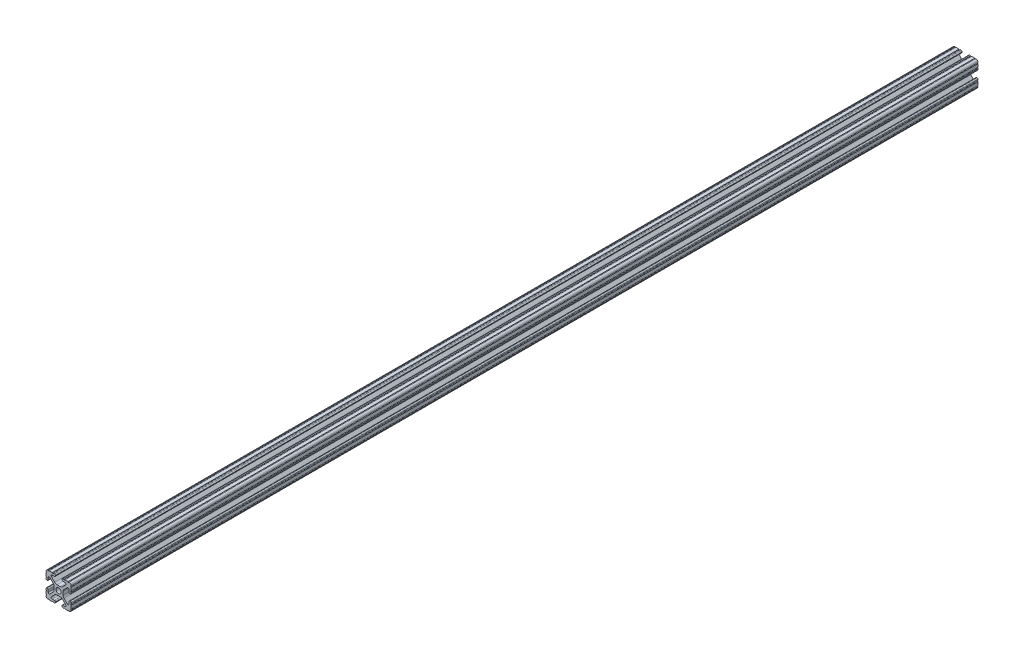
from build123d import *

# Parameters (mm, degrees)
SKETCH1_R      = 2.6035
EXTRUDE1_DEPTH = 914.4


with BuildPart() as part:
    # Sketch1 → Extrude1 (new body)
    with BuildSketch(Plane.XY):
        with BuildLine():
            Line((-7.207036008, 8.724370562), (-3.898272566, 5.423169045))
            ThreePointArc((-3.898272566, 5.423169045), (-2.869120213, 4.736787962), (-1.655778399, 4.4958))
            Line((-1.655778399, 4.4958), (1.655778399, 4.4958))
            ThreePointArc((1.655778399, 4.4958), (2.869120213, 4.736787962), (3.898272566, 5.423169045))
            Line((3.898272566, 5.423169045), (7.207036008, 8.724370562))
            ThreePointArc((7.207036008, 8.724370562), (7.432222385, 9.85140422), (6.476788598, 10.4902))
            Line((6.476788598, 10.4902), (4.287512407, 10.4902))
            ThreePointArc((4.287512407, 10.4902), (3.54574862, 10.79744862), (3.2385, 11.539212407))
            Line((3.2385, 11.539212407), (3.2385, 11.650987593))
            ThreePointArc((3.2385, 11.650987593), (3.54574862, 12.39275138), (4.287512407, 12.7))
            Line((4.287512407, 12.7), (5.317126718, 12.7))
            ThreePointArc((5.317126718, 12.7), (5.825126718, 12.192), (6.333126718, 12.7))
            Line((6.333126718, 12.7), (9.550443118, 12.7))
            ThreePointArc((9.550443118, 12.7), (10.058366869, 12.192000006), (10.566443095, 12.699847501))
            ThreePointArc((10.566443095, 12.699847501), (12.082537762, 12.08250727), (12.699846982, 10.566399977))
            ThreePointArc((12.699846982, 10.566399977), (12.192000006, 10.058323491), (12.7, 9.5504))
            Line((12.7, 9.5504), (12.7, 6.3330836))
            ThreePointArc((12.7, 6.3330836), (12.192, 5.8250836), (12.7, 5.3170836))
            Line((12.7, 5.3170836), (12.7, 4.287469289))
            ThreePointArc((12.7, 4.287469289), (12.39275138, 3.545705502), (11.650987593, 3.238456882))
            Line((11.650987593, 3.238456882), (11.539212407, 3.238456882))
            ThreePointArc((11.539212407, 3.238456882), (10.79744862, 3.545705502), (10.4902, 4.287469289))
            Line((10.4902, 4.287469289), (10.4902, 6.402089023))
            ThreePointArc((10.4902, 6.402089023), (9.856505071, 7.351067942), (8.737131347, 7.129408934))
            Line((8.737131347, 7.129408934), (5.441005833, 3.840816462))
            ThreePointArc((5.441005833, 3.840816462), (4.750877967, 2.809883091), (4.5085, 1.593185507))
            Line((4.5085, 1.593185507), (4.5085, -1.593185507))
            ThreePointArc((4.5085, -1.593185507), (4.750877967, -2.809883091), (5.441005833, -3.840816462))
            Line((5.441005833, -3.840816462), (8.737131347, -7.129408934))
            ThreePointArc((8.737131347, -7.129408934), (9.856505071, -7.351067942), (10.4902, -6.402089023))
            Line((10.4902, -6.402089023), (10.4902, -4.287469289))
            ThreePointArc((10.4902, -4.287469289), (10.79744862, -3.545705502), (11.539212407, -3.238456882))
            Line((11.539212407, -3.238456882), (11.650987593, -3.238456882))
            ThreePointArc((11.650987593, -3.238456882), (12.39275138, -3.545705502), (12.7, -4.287469289))
            Line((12.7, -4.287469289), (12.7, -5.3170836))
            ThreePointArc((12.7, -5.3170836), (12.192, -5.8250836), (12.7, -6.3330836))
            Line((12.7, -6.3330836), (12.7, -9.5504))
            ThreePointArc((12.7, -9.5504), (12.192000006, -10.058323491), (12.699846982, -10.566399977))
            ThreePointArc((12.699846982, -10.566399977), (12.082537762, -12.08250727), (10.566443095, -12.699847501))
            ThreePointArc((10.566443095, -12.699847501), (10.058366869, -12.192000006), (9.550443118, -12.7))
            Line((9.550443118, -12.7), (6.333126718, -12.7))
            ThreePointArc((6.333126718, -12.7), (5.825126718, -12.192), (5.317126718, -12.7))
            Line((5.317126718, -12.7), (4.287512407, -12.7))
            ThreePointArc((4.287512407, -12.7), (3.54574862, -12.39275138), (3.2385, -11.650987593))
            Line((3.2385, -11.650987593), (3.2385, -11.539212407))
            ThreePointArc((3.2385, -11.539212407), (3.54574862, -10.79744862), (4.287512407, -10.4902))
            Line((4.287512407, -10.4902), (6.416408329, -10.4902))
            ThreePointArc((6.416408329, -10.4902), (7.41473083, -9.822813117), (7.179650497, -8.645192506))
            Line((7.179650497, -8.645192506), (3.952270251, -5.423690499))
            ThreePointArc((3.952270251, -5.423690499), (2.922936451, -4.736929036), (1.709253557, -4.4958))
            Line((1.709253557, -4.4958), (-1.709253557, -4.4958))
            ThreePointArc((-1.709253557, -4.4958), (-2.922936451, -4.736929036), (-3.952270251, -5.423690499))
            Line((-3.952270251, -5.423690499), (-7.179650497, -8.645192506))
            ThreePointArc((-7.179650497, -8.645192506), (-7.41473083, -9.822813117), (-6.416408329, -10.4902))
            Line((-6.416408329, -10.4902), (-4.287512407, -10.4902))
            ThreePointArc((-4.287512407, -10.4902), (-3.54574862, -10.79744862), (-3.2385, -11.539212407))
            Line((-3.2385, -11.539212407), (-3.2385, -11.650987593))
            ThreePointArc((-3.2385, -11.650987593), (-3.54574862, -12.39275138), (-4.287512407, -12.7))
            Line((-4.287512407, -12.7), (-5.317126718, -12.7))
            ThreePointArc((-5.317126718, -12.7), (-5.825126718, -12.192), (-6.333126718, -12.7))
            Line((-6.333126718, -12.7), (-9.550443118, -12.7))
            ThreePointArc((-9.550443118, -12.7), (-10.058366869, -12.192000006), (-10.566443095, -12.699847501))
            ThreePointArc((-10.566443095, -12.699847501), (-12.082537762, -12.08250727), (-12.699846982, -10.566399977))
            ThreePointArc((-12.699846982, -10.566399977), (-12.192000006, -10.058323491), (-12.7, -9.5504))
            Line((-12.7, -9.5504), (-12.7, -6.3330836))
            ThreePointArc((-12.7, -6.3330836), (-12.192, -5.8250836), (-12.7, -5.3170836))
            Line((-12.7, -5.3170836), (-12.7, -4.287469289))
            ThreePointArc((-12.7, -4.287469289), (-12.39275138, -3.545705502), (-11.650987593, -3.238456882))
            Line((-11.650987593, -3.238456882), (-11.539212407, -3.238456882))
            ThreePointArc((-11.539212407, -3.238456882), (-10.79744862, -3.545705502), (-10.4902, -4.287469289))
            Line((-10.4902, -4.287469289), (-10.4902, -6.402089023))
            ThreePointArc((-10.4902, -6.402089023), (-9.856505071, -7.351067942), (-8.737131347, -7.129408934))
            Line((-8.737131347, -7.129408934), (-5.441005833, -3.840816462))
            ThreePointArc((-5.441005833, -3.840816462), (-4.750877967, -2.809883091), (-4.5085, -1.593185507))
            Line((-4.5085, -1.593185507), (-4.5085, 1.593185507))
            ThreePointArc((-4.5085, 1.593185507), (-4.750877967, 2.809883091), (-5.441005833, 3.840816462))
            Line((-5.441005833, 3.840816462), (-8.737131347, 7.129408934))
            ThreePointArc((-8.737131347, 7.129408934), (-9.856505071, 7.351067942), (-10.4902, 6.402089023))
            Line((-10.4902, 6.402089023), (-10.4902, 4.287469289))
            ThreePointArc((-10.4902, 4.287469289), (-10.79744862, 3.545705502), (-11.539212407, 3.238456882))
            Line((-11.539212407, 3.238456882), (-11.650987593, 3.238456882))
            ThreePointArc((-11.650987593, 3.238456882), (-12.39275138, 3.545705502), (-12.7, 4.287469289))
            Line((-12.7, 4.287469289), (-12.7, 5.3170836))
            ThreePointArc((-12.7, 5.3170836), (-12.192, 5.8250836), (-12.7, 6.3330836))
            Line((-12.7, 6.3330836), (-12.7, 9.5504))
            ThreePointArc((-12.7, 9.5504), (-12.192000006, 10.058323491), (-12.699846982, 10.566399977))
            ThreePointArc((-12.699846982, 10.566399977), (-12.082537762, 12.08250727), (-10.566443095, 12.699847501))
            ThreePointArc((-10.566443095, 12.699847501), (-10.058366869, 12.192000006), (-9.550443118, 12.7))
            Line((-9.550443118, 12.7), (-6.333126718, 12.7))
            ThreePointArc((-6.333126718, 12.7), (-5.825126718, 12.192), (-5.317126718, 12.7))
            Line((-5.317126718, 12.7), (-4.287512407, 12.7))
            ThreePointArc((-4.287512407, 12.7), (-3.54574862, 12.39275138), (-3.2385, 11.650987593))
            Line((-3.2385, 11.650987593), (-3.2385, 11.539212407))
            ThreePointArc((-3.2385, 11.539212407), (-3.54574862, 10.79744862), (-4.287512407, 10.4902))
            Line((-4.287512407, 10.4902), (-6.476788598, 10.4902))
            ThreePointArc((-6.476788598, 10.4902), (-7.432222385, 9.85140422), (-7.207036008, 8.724370562))
        make_face()
        Circle(SKETCH1_R, mode=Mode.SUBTRACT)
    extrude(amount=-EXTRUDE1_DEPTH)


solid = part.part
